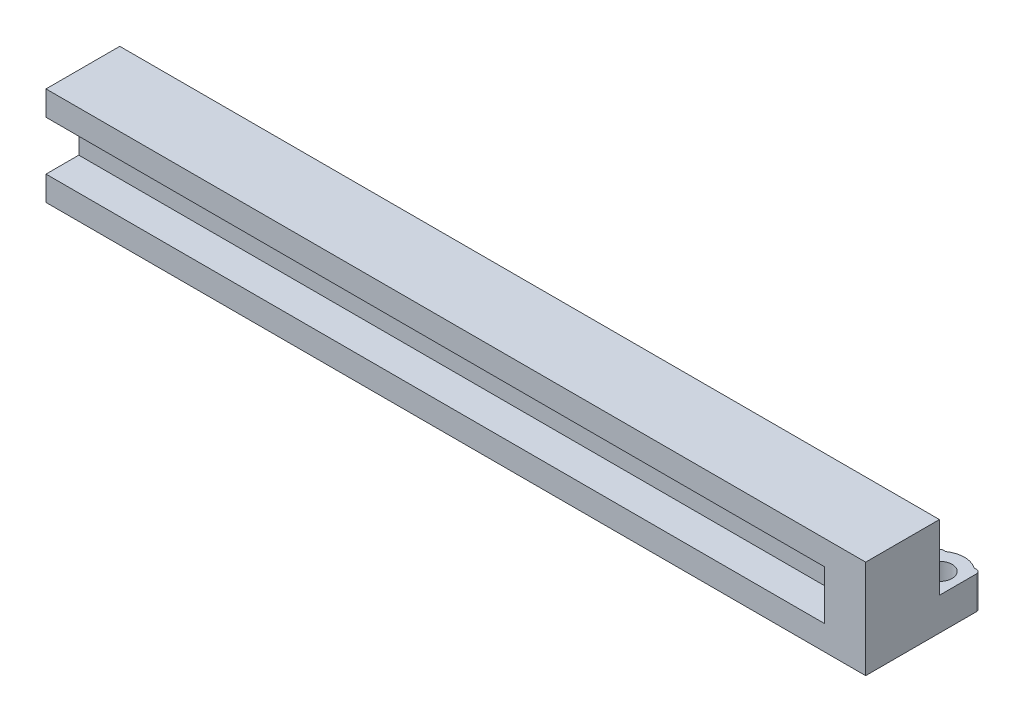
from build123d import *

# Parameters (mm, degrees)
ESQUISSE1_W        = 100
ESQUISSE1_H        = 12
BOSS_EXTRU_1_DEPTH = 5
BOSS_EXTRU_2_DEPTH = 4
ESQUISSE3_R        = 1.5
BOSS_EXTRU_3_DEPTH = 4


with BuildPart() as part:
    # Esquisse1 → Boss.-Extru.1 (new body)
    with BuildSketch(Plane.XY):
        Rectangle(ESQUISSE1_W, ESQUISSE1_H)
    extrude(amount=BOSS_EXTRU_1_DEPTH)

    # Esquisse2 → Boss.-Extru.2 (add)
    with BuildSketch(Plane.XY.offset(5)):
        Polygon((-50, 3), (45, 3), (45, -3), (-50, -3), (-50, -6), (50, -6), (50, 6), (-50, 6), align=None)
    extrude(amount=BOSS_EXTRU_2_DEPTH)

    # Esquisse3 → Boss.-Extru.3 (add)
    # profile 1 of 3: a face of its own
    with BuildSketch(Plane.XZ.offset(6)):
        with BuildLine():
            Line((-45.71168799, -5), (-45.5, -5))
            ThreePointArc((-45.5, -5), (-45.146446609, -4.853553391), (-45, -4.5))
            Line((-45, -4.5), (-45, 0))
            Line((-45, 0), (-50, 0))
            Line((-50, 0), (-50, -4.5))
            ThreePointArc((-50, -4.5), (-49.853553391, -4.853553391), (-49.5, -5))
            Line((-49.5, -5), (-49.28831201, -5))
            ThreePointArc((-49.28831201, -5), (-49.22893784, -5.008856171), (-49.174732569, -5.034653697))
            ThreePointArc((-49.174732569, -5.034653697), (-47.5, -5.545623601), (-45.825267431, -5.034653697))
            ThreePointArc((-45.825267431, -5.034653697), (-45.77106216, -5.008856171), (-45.71168799, -5))
        make_face()
        with Locations(Location((-47.5, -2.545623601, 0), (0, 0, 270))):
            Circle(ESQUISSE3_R, mode=Mode.SUBTRACT)
    # profile 2 of 3: a face of its own
    with BuildSketch(Plane.XZ.offset(6)):
        with BuildLine():
            Line((49.5, -5), (49.28831201, -5))
            ThreePointArc((49.28831201, -5), (49.22893784, -5.008856171), (49.174732569, -5.034653697))
            ThreePointArc((49.174732569, -5.034653697), (47.5, -5.545623601), (45.825267431, -5.034653697))
            ThreePointArc((45.825267431, -5.034653697), (45.77106216, -5.008856171), (45.71168799, -5))
            Line((45.71168799, -5), (45.5, -5))
            ThreePointArc((45.5, -5), (45.146446609, -4.853553391), (45, -4.5))
            Line((45, -4.5), (45, 0))
            Line((45, 0), (50, 0))
            Line((50, 0), (50, -4.5))
            ThreePointArc((50, -4.5), (49.853553391, -4.853553391), (49.5, -5))
        make_face()
        with Locations(Location((47.5, -2.545623601, 0), (0, 0, 90))):
            Circle(ESQUISSE3_R, mode=Mode.SUBTRACT)
    # profile 3 of 3: a face of its own
    with BuildSketch(Plane.XZ.offset(6)):
        with BuildLine():
            Line((-2.5, 0), (-2.5, -4.5))
            ThreePointArc((-2.5, -4.5), (-2.353553391, -4.853553391), (-2, -5))
            Line((-2, -5), (-1.78831201, -5))
            ThreePointArc((-1.78831201, -5), (-1.72893784, -5.008856171), (-1.674732569, -5.034653697))
            ThreePointArc((-1.674732569, -5.034653697), (0, -5.545623601), (1.674732569, -5.034653697))
            ThreePointArc((1.674732569, -5.034653697), (1.72893784, -5.008856171), (1.78831201, -5))
            Line((1.78831201, -5), (2, -5))
            ThreePointArc((2, -5), (2.353553391, -4.853553391), (2.5, -4.5))
            Line((2.5, -4.5), (2.5, 0))
            Line((2.5, 0), (-2.5, 0))
        make_face()
        with Locations(Location((0, -2.545623601, 0), (0, 0, 270))):
            Circle(ESQUISSE3_R, mode=Mode.SUBTRACT)
    extrude(amount=-BOSS_EXTRU_3_DEPTH)


solid = part.part
